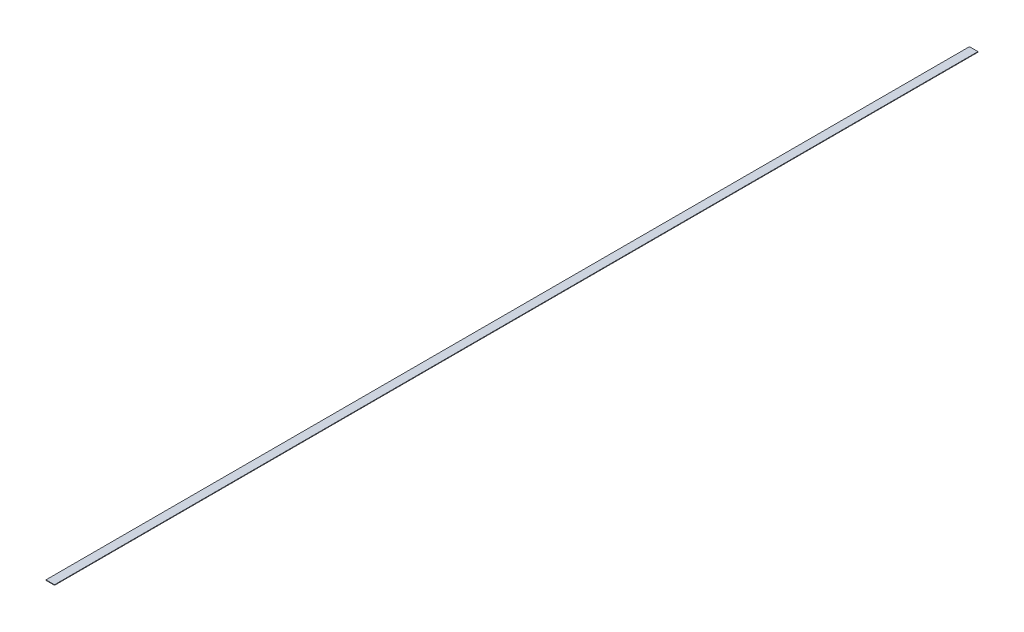
from build123d import *

# Parameters (mm, degrees)
SKETCH1_W           = 50.8
SKETCH1_H           = 5492.75
BOSS_EXTRUDE1_DEPTH = 3.175


with BuildPart() as part:
    # Sketch1 → Boss-Extrude1 (new body)
    with BuildSketch(Plane(origin=(0, 0, 0), x_dir=(1, 0, 0), z_dir=(0, 1, 0))):
        Rectangle(SKETCH1_W, SKETCH1_H)
    extrude(amount=BOSS_EXTRUDE1_DEPTH)


solid = part.part
